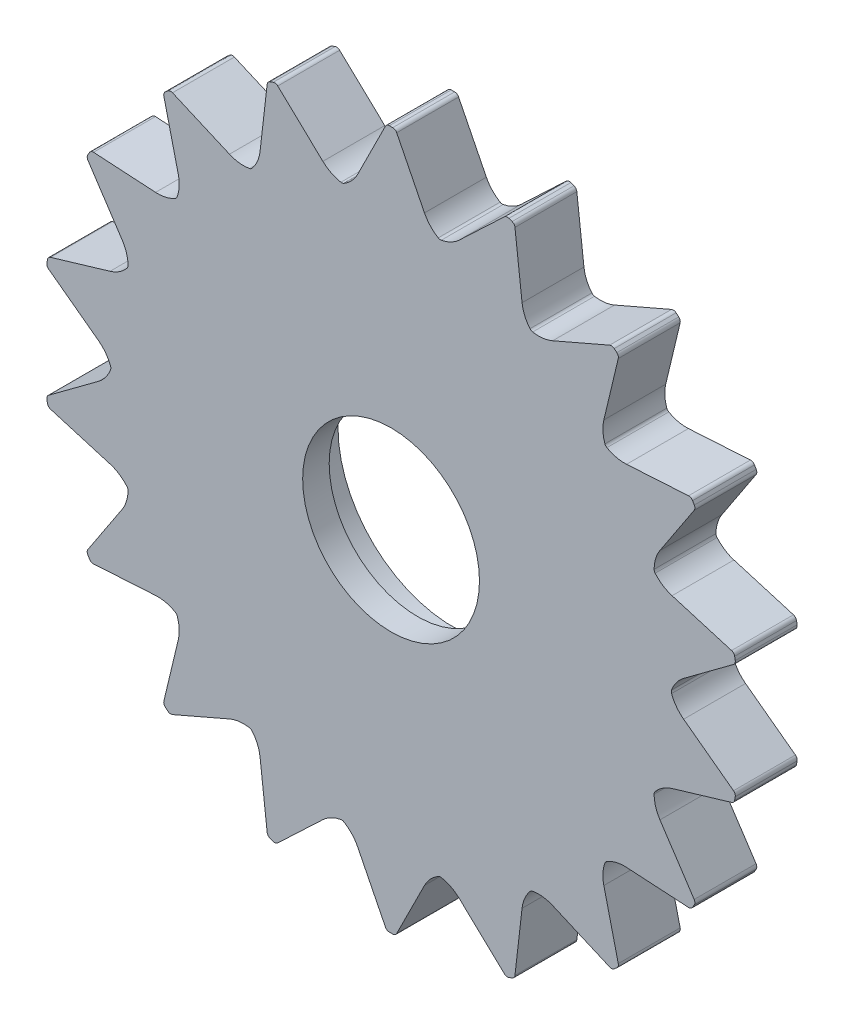
from build123d import *

# Parameters (mm, degrees)
SKETCH1_R           = 10
BOSS_EXTRUDE1_DEPTH = 7
SKETCH2_R           = 13
CUT_EXTRUDE1_DEPTH  = 4


with BuildPart() as part:
    # Sketch1 → Boss-Extrude1 (new body)
    with BuildSketch(Plane.XY):
        with BuildLine():
            Line((12.815174401, 37.076049624), (7.714377278, 32.246568473))
            ThreePointArc((7.714377278, 32.246568473), (6.772418835, 31.583201482), (5.680457214, 31.215830703))
            ThreePointArc((5.680457214, 31.215830703), (5.504107847, 31.215346764), (5.338559164, 31.276116554))
            ThreePointArc((5.338559164, 31.276116554), (4.438099093, 31.994805034), (3.779832569, 32.940334862))
            Line((3.779832569, 32.940334862), (0.638430988, 39.223138025))
            ThreePointArc((0.638430988, 39.223138025), (0.455124849, 39.424210935), (0.193668897, 39.499525217))
            ThreePointArc((0.193668897, 39.499525217), (0, 39.5), (-0.193668897, 39.499525217))
            ThreePointArc((-0.193668897, 39.499525217), (-0.455124849, 39.424210935), (-0.638430988, 39.223138025))
            Line((-0.638430988, 39.223138025), (-3.779832569, 32.940334862))
            ThreePointArc((-3.779832569, 32.940334862), (-4.438099093, 31.994805034), (-5.338559164, 31.276116554))
            ThreePointArc((-5.338559164, 31.276116554), (-5.504107847, 31.215346764), (-5.680457214, 31.215830703))
            ThreePointArc((-5.680457214, 31.215830703), (-6.772418835, 31.583201482), (-7.714377278, 32.246568473))
            Line((-7.714377278, 32.246568473), (-12.815174401, 37.076049624))
            ThreePointArc((-12.815174401, 37.076049624), (-13.056196812, 37.202301962), (-13.327644042, 37.183651035))
            ThreePointArc((-13.327644042, 37.183651035), (-13.509795661, 37.117858521), (-13.69162251, 37.051173707))
            ThreePointArc((-13.69162251, 37.051173707), (-13.911551736, 36.89097823), (-14.015032177, 36.639337108))
            Line((-14.015032177, 36.639337108), (-14.818138824, 29.661010719))
            ThreePointArc((-14.818138824, 29.661010719), (-15.113316771, 28.547362906), (-15.713666519, 27.564041162))
            ThreePointArc((-15.713666519, 27.564041162), (-15.848446901, 27.450315254), (-16.014326618, 27.390454973))
            ThreePointArc((-16.014326618, 27.390454973), (-17.166083102, 27.362197713), (-18.278119373, 27.663390017))
            Line((-18.278119373, 27.663390017), (-24.723080625, 30.457042454))
            ThreePointArc((-24.723080625, 30.457042454), (-24.992748449, 30.493246325), (-25.241446415, 30.382879766))
            ThreePointArc((-25.241446415, 30.382879766), (-25.390110583, 30.258755503), (-25.53816438, 30.133903831))
            ThreePointArc((-25.53816438, 30.133903831), (-25.690040172, 29.908149097), (-25.701213646, 29.636291397))
            Line((-25.701213646, 29.636291397), (-24.069158844, 22.804130933))
            ThreePointArc((-24.069158844, 22.804130933), (-23.965645398, 21.656687497), (-24.193473782, 20.527335604))
            ThreePointArc((-24.193473782, 20.527335604), (-24.281229362, 20.374370602), (-24.416631885, 20.261386133))
            ThreePointArc((-24.416631885, 20.261386133), (-25.489264402, 19.840909076), (-26.637250515, 19.743598458))
            Line((-26.637250515, 19.743598458), (-33.649018452, 20.164466466))
            ThreePointArc((-33.649018452, 20.164466466), (-33.914805769, 20.106255148), (-34.110757827, 19.917484793))
            ThreePointArc((-34.110757827, 19.917484793), (-34.208003449, 19.75), (-34.304426724, 19.582040423))
            ThreePointArc((-34.304426724, 19.582040423), (-34.369930618, 19.317955786), (-34.287449439, 19.058671558))
            Line((-34.287449439, 19.058671558), (-30.417083084, 13.196736404))
            ThreePointArc((-30.417083084, 13.196736404), (-29.927363495, 12.153895958), (-29.75519105, 11.014730421))
            ThreePointArc((-29.75519105, 11.014730421), (-29.785337208, 10.840976161), (-29.873930996, 10.688495099))
            ThreePointArc((-29.873930996, 10.688495099), (-30.738064234, 9.926513984), (-31.783536121, 9.44243754))
            Line((-31.783536121, 9.44243754), (-38.516388046, 7.439758227))
            ThreePointArc((-38.516388046, 7.439758227), (-38.746236984, 7.294152865), (-38.865808423, 7.049747204))
            ThreePointArc((-38.865808423, 7.049747204), (-38.899906244, 6.859103018), (-38.933068925, 6.668293941))
            ThreePointArc((-38.933068925, 6.668293941), (-38.904300186, 6.397731905), (-38.738112802, 6.182294654))
            Line((-38.738112802, 6.182294654), (-33.096258196, 1.997620701))
            ThreePointArc((-33.096258196, 1.997620701), (-32.279399873, 1.185165194), (-31.727993137, 0.173586189))
            ThreePointArc((-31.727993137, 0.173586189), (-31.696893803, 0), (-31.727993137, -0.173586189))
            ThreePointArc((-31.727993137, -0.173586189), (-32.279399873, -1.185165194), (-33.096258196, -1.997620701))
            Line((-33.096258196, -1.997620701), (-38.738112802, -6.182294654))
            ThreePointArc((-38.738112802, -6.182294654), (-38.904300186, -6.397731905), (-38.933068925, -6.668293941))
            ThreePointArc((-38.933068925, -6.668293941), (-38.899906244, -6.859103018), (-38.865808423, -7.049747204))
            ThreePointArc((-38.865808423, -7.049747204), (-38.746236984, -7.294152865), (-38.516388046, -7.439758227))
            Line((-38.516388046, -7.439758227), (-31.783536121, -9.44243754))
            ThreePointArc((-31.783536121, -9.44243754), (-30.738064234, -9.926513984), (-29.873930996, -10.688495099))
            ThreePointArc((-29.873930996, -10.688495099), (-29.785337208, -10.840976161), (-29.75519105, -11.014730421))
            ThreePointArc((-29.75519105, -11.014730421), (-29.927363495, -12.153895958), (-30.417083084, -13.196736404))
            Line((-30.417083084, -13.196736404), (-34.287449439, -19.058671558))
            ThreePointArc((-34.287449439, -19.058671558), (-34.369930618, -19.317955786), (-34.304426724, -19.582040423))
            ThreePointArc((-34.304426724, -19.582040423), (-34.208003449, -19.75), (-34.110757827, -19.917484793))
            ThreePointArc((-34.110757827, -19.917484793), (-33.914805769, -20.106255148), (-33.649018452, -20.164466466))
            Line((-33.649018452, -20.164466466), (-26.637250515, -19.743598458))
            ThreePointArc((-26.637250515, -19.743598458), (-25.489264402, -19.840909076), (-24.416631885, -20.261386133))
            ThreePointArc((-24.416631885, -20.261386133), (-24.281229362, -20.374370602), (-24.193473782, -20.527335604))
            ThreePointArc((-24.193473782, -20.527335604), (-23.965645398, -21.656687497), (-24.069158844, -22.804130933))
            Line((-24.069158844, -22.804130933), (-25.701213646, -29.636291397))
            ThreePointArc((-25.701213646, -29.636291397), (-25.690040172, -29.908149097), (-25.53816438, -30.133903831))
            ThreePointArc((-25.53816438, -30.133903831), (-25.390110583, -30.258755503), (-25.241446415, -30.382879766))
            ThreePointArc((-25.241446415, -30.382879766), (-24.992748449, -30.493246325), (-24.723080625, -30.457042454))
            Line((-24.723080625, -30.457042454), (-18.278119373, -27.663390017))
            ThreePointArc((-18.278119373, -27.663390017), (-17.166083102, -27.362197713), (-16.014326618, -27.390454973))
            ThreePointArc((-16.014326618, -27.390454973), (-15.848446901, -27.450315254), (-15.713666519, -27.564041162))
            ThreePointArc((-15.713666519, -27.564041162), (-15.113316771, -28.547362906), (-14.818138824, -29.661010719))
            Line((-14.818138824, -29.661010719), (-14.015032177, -36.639337108))
            ThreePointArc((-14.015032177, -36.639337108), (-13.911551736, -36.89097823), (-13.69162251, -37.051173707))
            ThreePointArc((-13.69162251, -37.051173707), (-13.509795661, -37.117858521), (-13.327644042, -37.183651035))
            ThreePointArc((-13.327644042, -37.183651035), (-13.056196812, -37.202301962), (-12.815174401, -37.076049624))
            Line((-12.815174401, -37.076049624), (-7.714377278, -32.246568473))
            ThreePointArc((-7.714377278, -32.246568473), (-6.772418835, -31.583201482), (-5.680457214, -31.215830703))
            ThreePointArc((-5.680457214, -31.215830703), (-5.504107847, -31.215346764), (-5.338559164, -31.276116554))
            ThreePointArc((-5.338559164, -31.276116554), (-4.438099093, -31.994805034), (-3.779832569, -32.940334862))
            Line((-3.779832569, -32.940334862), (-0.638430988, -39.223138025))
            ThreePointArc((-0.638430988, -39.223138025), (-0.455124849, -39.424210935), (-0.193668897, -39.499525217))
            ThreePointArc((-0.193668897, -39.499525217), (0, -39.5), (0.193668897, -39.499525217))
            ThreePointArc((0.193668897, -39.499525217), (0.455124849, -39.424210935), (0.638430988, -39.223138025))
            Line((0.638430988, -39.223138025), (3.779832569, -32.940334862))
            ThreePointArc((3.779832569, -32.940334862), (4.438099093, -31.994805034), (5.338559164, -31.276116554))
            ThreePointArc((5.338559164, -31.276116554), (5.504107847, -31.215346764), (5.680457214, -31.215830703))
            ThreePointArc((5.680457214, -31.215830703), (6.772418835, -31.583201482), (7.714377278, -32.246568473))
            Line((7.714377278, -32.246568473), (12.815174401, -37.076049624))
            ThreePointArc((12.815174401, -37.076049624), (13.056196812, -37.202301962), (13.327644042, -37.183651035))
            ThreePointArc((13.327644042, -37.183651035), (13.509795661, -37.117858521), (13.69162251, -37.051173707))
            ThreePointArc((13.69162251, -37.051173707), (13.911551736, -36.89097823), (14.015032177, -36.639337108))
            Line((14.015032177, -36.639337108), (14.818138824, -29.661010719))
            ThreePointArc((14.818138824, -29.661010719), (15.113316771, -28.547362906), (15.713666519, -27.564041162))
            ThreePointArc((15.713666519, -27.564041162), (15.848446901, -27.450315254), (16.014326618, -27.390454973))
            ThreePointArc((16.014326618, -27.390454973), (17.166083102, -27.362197713), (18.278119373, -27.663390017))
            Line((18.278119373, -27.663390017), (24.723080625, -30.457042454))
            ThreePointArc((24.723080625, -30.457042454), (24.992748449, -30.493246325), (25.241446415, -30.382879766))
            ThreePointArc((25.241446415, -30.382879766), (25.390110583, -30.258755503), (25.53816438, -30.133903831))
            ThreePointArc((25.53816438, -30.133903831), (25.690040172, -29.908149097), (25.701213646, -29.636291397))
            Line((25.701213646, -29.636291397), (24.069158844, -22.804130933))
            ThreePointArc((24.069158844, -22.804130933), (23.965645398, -21.656687497), (24.193473782, -20.527335604))
            ThreePointArc((24.193473782, -20.527335604), (24.281229362, -20.374370602), (24.416631885, -20.261386133))
            ThreePointArc((24.416631885, -20.261386133), (25.489264402, -19.840909076), (26.637250515, -19.743598458))
            Line((26.637250515, -19.743598458), (33.649018452, -20.164466466))
            ThreePointArc((33.649018452, -20.164466466), (33.914805769, -20.106255148), (34.110757827, -19.917484793))
            ThreePointArc((34.110757827, -19.917484793), (34.208003449, -19.75), (34.304426724, -19.582040423))
            ThreePointArc((34.304426724, -19.582040423), (34.369930618, -19.317955786), (34.287449439, -19.058671558))
            Line((34.287449439, -19.058671558), (30.417083084, -13.196736404))
            ThreePointArc((30.417083084, -13.196736404), (29.927363495, -12.153895958), (29.75519105, -11.014730421))
            ThreePointArc((29.75519105, -11.014730421), (29.785337208, -10.840976161), (29.873930996, -10.688495099))
            ThreePointArc((29.873930996, -10.688495099), (30.738064234, -9.926513984), (31.783536121, -9.44243754))
            Line((31.783536121, -9.44243754), (38.516388046, -7.439758227))
            ThreePointArc((38.516388046, -7.439758227), (38.746236984, -7.294152865), (38.865808423, -7.049747204))
            ThreePointArc((38.865808423, -7.049747204), (38.899906244, -6.859103018), (38.933068925, -6.668293941))
            ThreePointArc((38.933068925, -6.668293941), (38.904300186, -6.397731905), (38.738112802, -6.182294654))
            Line((38.738112802, -6.182294654), (33.096258196, -1.997620701))
            ThreePointArc((33.096258196, -1.997620701), (32.279399873, -1.185165194), (31.727993137, -0.173586189))
            ThreePointArc((31.727993137, -0.173586189), (31.696893803, 0), (31.727993137, 0.173586189))
            ThreePointArc((31.727993137, 0.173586189), (32.279399873, 1.185165194), (33.096258196, 1.997620701))
            Line((33.096258196, 1.997620701), (38.738112802, 6.182294654))
            ThreePointArc((38.738112802, 6.182294654), (38.904300186, 6.397731905), (38.933068925, 6.668293941))
            ThreePointArc((38.933068925, 6.668293941), (38.899906244, 6.859103018), (38.865808423, 7.049747204))
            ThreePointArc((38.865808423, 7.049747204), (38.746236984, 7.294152865), (38.516388046, 7.439758227))
            Line((38.516388046, 7.439758227), (31.783536121, 9.44243754))
            ThreePointArc((31.783536121, 9.44243754), (30.738064234, 9.926513984), (29.873930996, 10.688495099))
            ThreePointArc((29.873930996, 10.688495099), (29.785337208, 10.840976161), (29.75519105, 11.014730421))
            ThreePointArc((29.75519105, 11.014730421), (29.927363495, 12.153895958), (30.417083084, 13.196736404))
            Line((30.417083084, 13.196736404), (34.287449439, 19.058671558))
            ThreePointArc((34.287449439, 19.058671558), (34.369930618, 19.317955786), (34.304426724, 19.582040423))
            ThreePointArc((34.304426724, 19.582040423), (34.208003449, 19.75), (34.110757827, 19.917484793))
            ThreePointArc((34.110757827, 19.917484793), (33.914805769, 20.106255148), (33.649018452, 20.164466466))
            Line((33.649018452, 20.164466466), (26.637250515, 19.743598458))
            ThreePointArc((26.637250515, 19.743598458), (25.489264402, 19.840909076), (24.416631885, 20.261386133))
            ThreePointArc((24.416631885, 20.261386133), (24.281229362, 20.374370602), (24.193473782, 20.527335604))
            ThreePointArc((24.193473782, 20.527335604), (23.965645398, 21.656687497), (24.069158844, 22.804130933))
            Line((24.069158844, 22.804130933), (25.701213646, 29.636291397))
            ThreePointArc((25.701213646, 29.636291397), (25.690040172, 29.908149097), (25.53816438, 30.133903831))
            ThreePointArc((25.53816438, 30.133903831), (25.390110583, 30.258755503), (25.241446415, 30.382879766))
            ThreePointArc((25.241446415, 30.382879766), (24.992748449, 30.493246325), (24.723080625, 30.457042454))
            Line((24.723080625, 30.457042454), (18.278119373, 27.663390017))
            ThreePointArc((18.278119373, 27.663390017), (17.166083102, 27.362197713), (16.014326618, 27.390454973))
            ThreePointArc((16.014326618, 27.390454973), (15.848446901, 27.450315254), (15.713666519, 27.564041162))
            ThreePointArc((15.713666519, 27.564041162), (15.113316771, 28.547362906), (14.818138824, 29.661010719))
            Line((14.818138824, 29.661010719), (14.015032177, 36.639337108))
            ThreePointArc((14.015032177, 36.639337108), (13.911551736, 36.89097823), (13.69162251, 37.051173707))
            ThreePointArc((13.69162251, 37.051173707), (13.509795661, 37.117858521), (13.327644042, 37.183651035))
            ThreePointArc((13.327644042, 37.183651035), (13.056196812, 37.202301962), (12.815174401, 37.076049624))
        make_face()
        Circle(SKETCH1_R, mode=Mode.SUBTRACT)
    extrude(amount=BOSS_EXTRUDE1_DEPTH)

    # Sketch2 → Cut-Extrude1 (cut)
    with BuildSketch(Plane(origin=(0, 0, 0), x_dir=(-1, 0, 0), z_dir=(0, 0, -1))):
        Circle(SKETCH2_R)
    extrude(amount=-CUT_EXTRUDE1_DEPTH, mode=Mode.SUBTRACT)


solid = part.part
